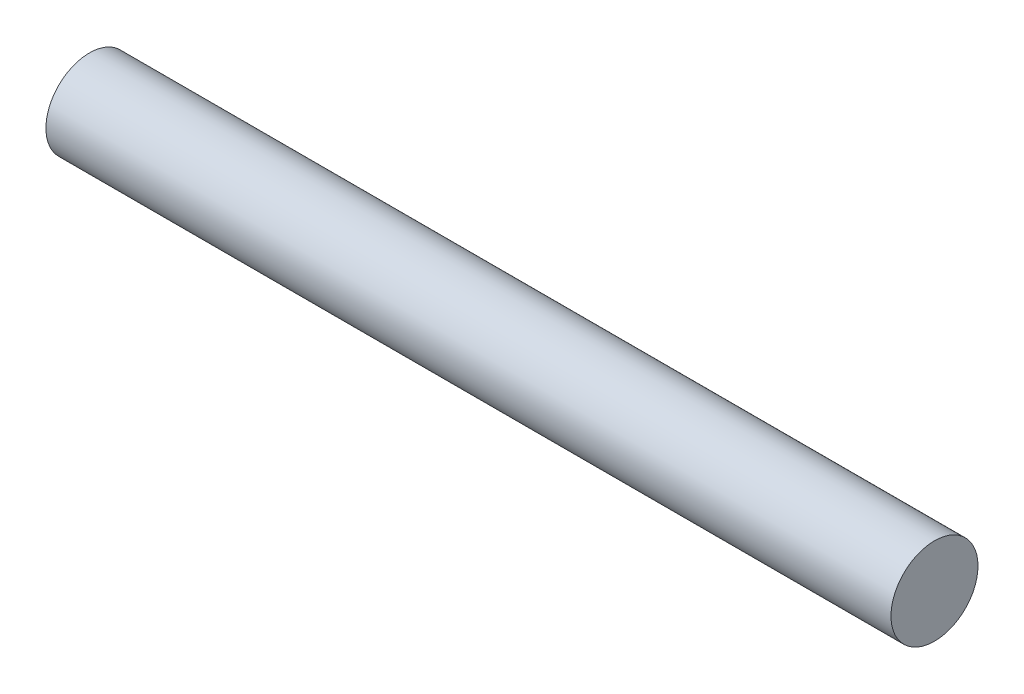
from build123d import *

# Parameters (mm, degrees)
SKETCH1_R      = 19.05
EXTRUDE1_DEPTH = 185


with BuildPart() as part:
    # Sketch1 → Extrude1 (new, symmetric)
    with BuildSketch(Plane(origin=(0, 0, 0), x_dir=(0, 0, -1), z_dir=(1, 0, 0))):
        Circle(SKETCH1_R)
    extrude(amount=EXTRUDE1_DEPTH, both=True)


solid = part.part
